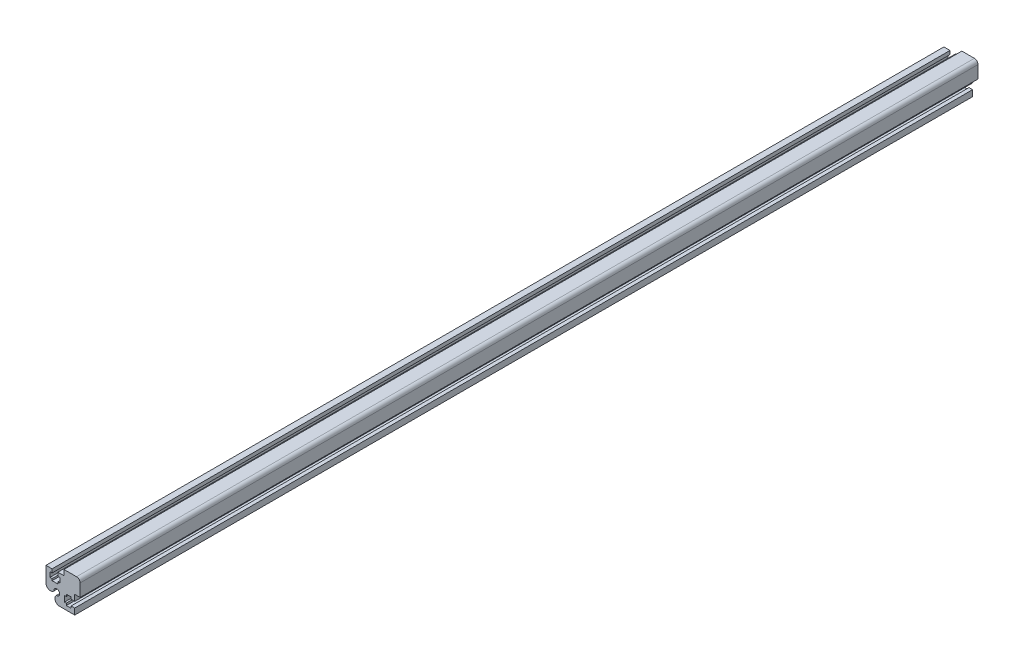
from build123d import *

# Parameters (mm, degrees)
EXTRUDE_1_DEPTH = 500


with BuildPart() as part:
    # Model → 凸台-拉伸1 (new body)
    with BuildSketch(Plane.XY):
        with BuildLine():
            Line((-6, 1.449747468), (-6, 10))
            Line((-6, 10), (-2.6, 10))
            Line((-2.6, 10), (-2.6, 8))
            Line((-2.6, 8), (-3.75, 8))
            Line((-3.75, 8), (-3.75, 5.3))
            Line((-3.75, 5.3), (-2.6, 5.3))
            Line((-2.6, 5.3), (-2.6, 4.29034466))
            Line((-2.6, 4.29034466), (0.6, 4.29034466))
            Line((0.6, 4.29034466), (0.6, 5.3))
            Line((0.6, 5.3), (1.75, 5.3))
            Line((1.75, 5.3), (1.75, 8))
            Line((1.75, 8), (0.6, 8))
            Line((0.6, 8), (0.6, 10))
            Line((0.6, 10), (4, 10))
            Line((4, 10), (4, 13))
            Line((4, 13), (11, 13))
            ThreePointArc((11, 13), (12.414213562, 12.414213562), (13, 11))
            Line((13, 11), (13, 4))
            Line((13, 4), (10, 4))
            Line((10, 4), (10, 0.6))
            Line((10, 0.6), (8, 0.6))
            Line((8, 0.6), (8, 1.75))
            Line((8, 1.75), (5.3, 1.75))
            Line((5.3, 1.75), (5.3, 0.6))
            Line((5.3, 0.6), (4.29034466, 0.6))
            Line((4.29034466, 0.6), (4.29034466, -2.6))
            Line((4.29034466, -2.6), (5.3, -2.6))
            Line((5.3, -2.6), (5.3, -3.75))
            Line((5.3, -3.75), (8, -3.75))
            Line((8, -3.75), (8, -2.6))
            Line((8, -2.6), (10, -2.6))
            Line((10, -2.6), (10, -6))
            Line((10, -6), (1.449747468, -6))
            ThreePointArc((1.449747468, -6), (-0.859951363, -4.456708581), (-0.318019485, -1.732233047))
            Line((-0.318019485, -1.732233047), (-0.220928778, -1.635142341))
            ThreePointArc((-0.220928778, -1.635142341), (1.166726189, 1.166726189), (-1.635142341, -0.220928778))
            Line((-1.635142341, -0.220928778), (-1.732233047, -0.318019485))
            ThreePointArc((-1.732233047, -0.318019485), (-4.456708581, -0.859951363), (-6, 1.449747468))
        make_face()
    extrude(amount=EXTRUDE_1_DEPTH)


solid = part.part
